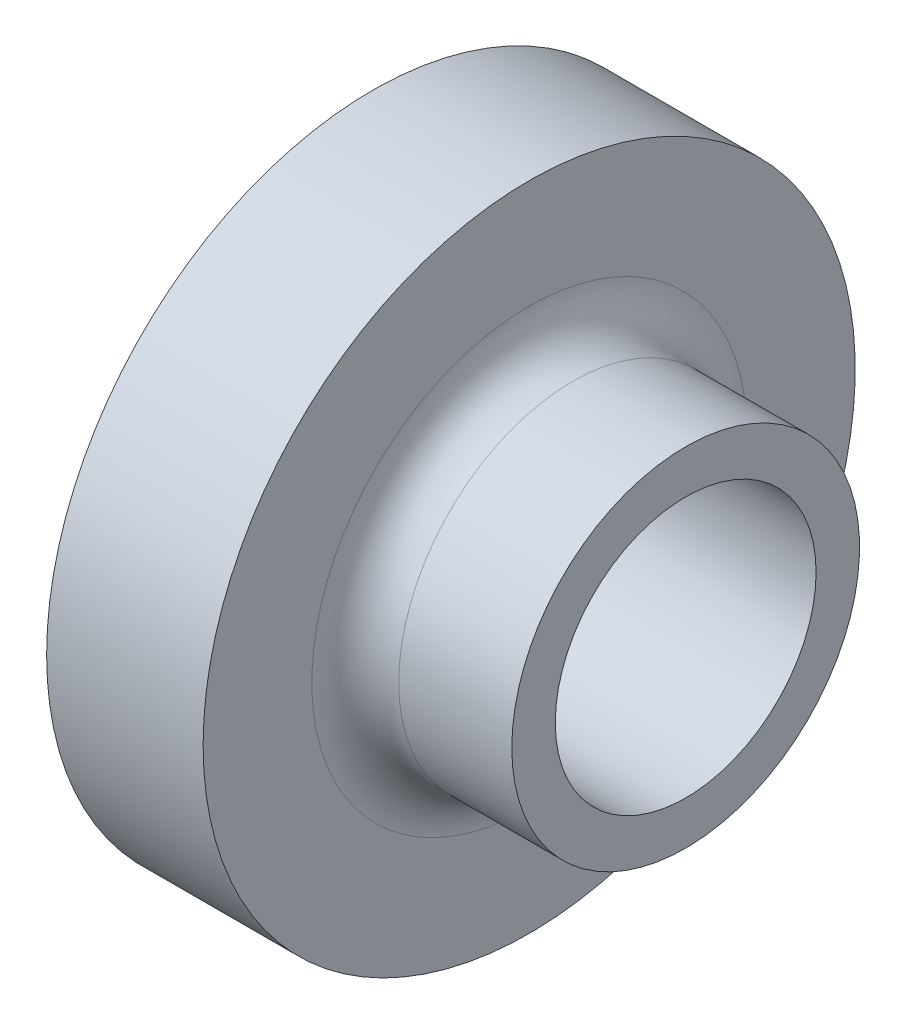
from build123d import *

# Parameters (mm, degrees)
RADYUS1_R = 5


with BuildPart() as part:
    # Çizim1 → Döndür1 (revolve)
    with BuildSketch(Plane.XY, mode=Mode.PRIVATE) as d_nd_r1_sk:
        Polygon((0, 37.5), (0, 15), (36, 15), (36, 20), (18, 20), (18, 37.5), align=None)
    revolve(d_nd_r1_sk.sketch.rotate(Axis((0, 0, 0), (1, 0, 0)), 90), axis=Axis((0, 0, 0), (1, 0, 0)))

    # Radyus1
    radyus1_edges = [part.edges().sort_by_distance(p)[0] for p in [
        (18, 0, -20),
    ]]
    fillet(radyus1_edges, radius=RADYUS1_R)


solid = part.part
